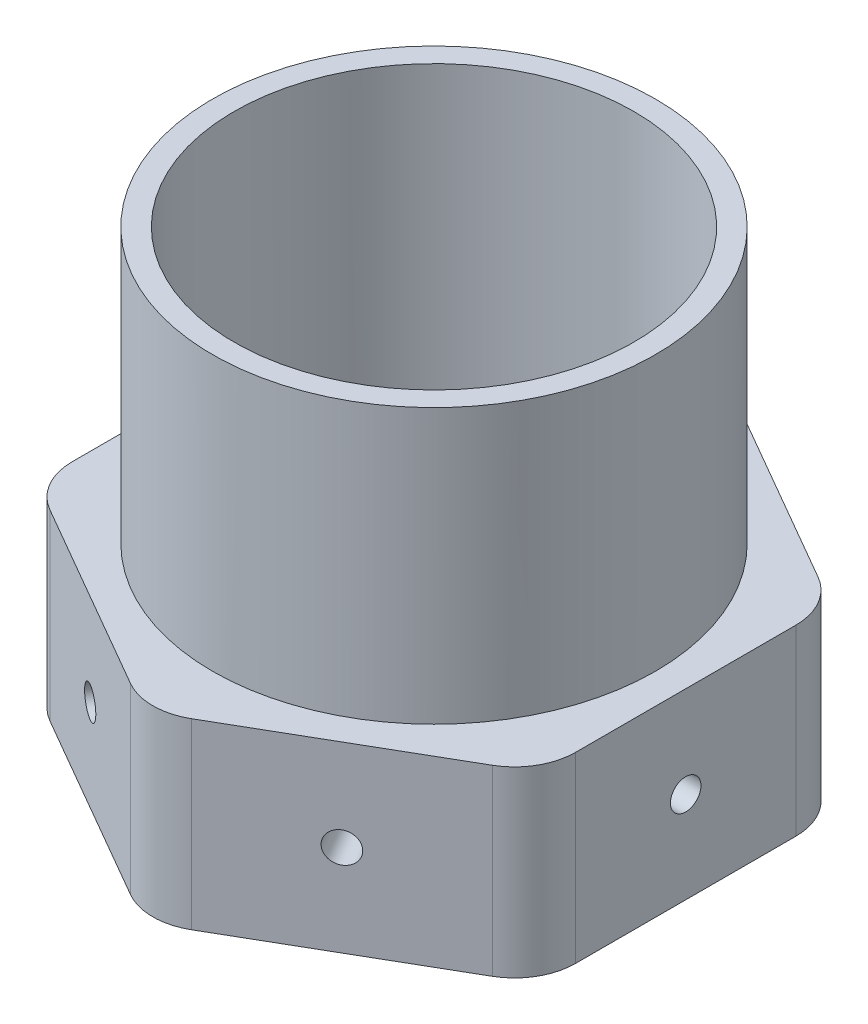
from build123d import *

# Parameters (mm, degrees)
SKETCH1_R           = 41.656
BOSS_EXTRUDE1_DEPTH = 38.1
SKETCH2_R           = 3.18135
CUT_EXTRUDE1_DEPTH  = 29.464
CIRPATTERN1_COUNT   = 6
SKETCH3_R           = 46.1518
SKETCH3_R_2         = 41.656
BOSS_EXTRUDE2_DEPTH = 57.15
FILLET1_R           = 12.7


with BuildPart() as part:
    # Sketch1 → Boss-Extrude1 (new body)
    with BuildSketch(Plane(origin=(0, 0, 0), x_dir=(1, 0, 0), z_dir=(0, 1, 0))):
        Polygon((0, -60.565197939), (52.451, -30.282598969), (52.451, 30.282598969), (0, 60.565197939), (-52.451, 30.282598969), (-52.451, -30.282598969), align=None)
        with Locations(Location((0, 0, 0), (0, 0, 90))):
            Circle(SKETCH1_R, mode=Mode.SUBTRACT)
    extrude(amount=BOSS_EXTRUDE1_DEPTH)

    # Sketch2 → Cut-Extrude1 (cut)
    with BuildSketch(Plane.ZY.offset(52.451)):
        with Locations((0, 19.05)):
            Circle(SKETCH2_R)
    cut_extrude1 = extrude(amount=-CUT_EXTRUDE1_DEPTH, mode=Mode.SUBTRACT)

    # CirPattern1: Cut-Extrude1 ×6 about axis
    cirpattern1_axis = Axis((0, 38.1, 0), (0, 1, 0))
    for i in range(1, CIRPATTERN1_COUNT):
        add(cut_extrude1.rotate(cirpattern1_axis, i * 360 / CIRPATTERN1_COUNT), mode=Mode.SUBTRACT)

    # Sketch3 → Boss-Extrude2 (add)
    with BuildSketch(Plane(origin=(-52.451, 38.1, -30.282598969), x_dir=(1, 0, 0), z_dir=(0, -1, 0))):
        with Locations(Location((52.451, 30.282598969, 0), (0, 0, 270))):
            Circle(SKETCH3_R)
        with Locations(Location((52.451, 30.282598969, 0), (0, 0, 270))):
            Circle(SKETCH3_R_2, mode=Mode.SUBTRACT)
    extrude(amount=-BOSS_EXTRUDE2_DEPTH)

    # Fillet1
    fillet1_edges = [part.edges().sort_by_distance(p)[0] for p in [
        (-52.451, 19.05, 30.282598969),
        (-52.451, 19.05, -30.282598969),
        (0, 19.05, -60.565197939),
        (52.451, 19.05, -30.282598969),
        (52.451, 19.05, 30.282598969),
        (0, 19.05, 60.565197939),
    ]]
    fillet(fillet1_edges, radius=FILLET1_R)


solid = part.part
